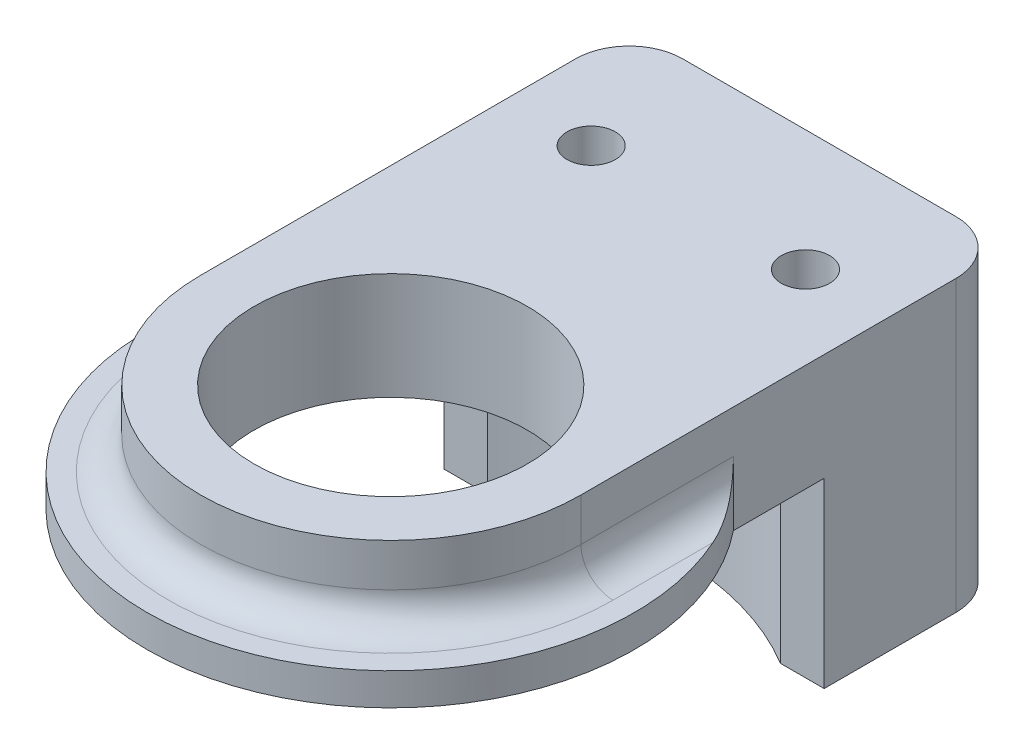
from build123d import *

# Parameters (mm, degrees)
SKETCH1_R           = 22.75
SKETCH1_R_2         = 12.75
BOSS_EXTRUDE1_DEPTH = 3
SKETCH2_R           = 12.75
BOSS_EXTRUDE2_DEPTH = 7
BOSS_EXTRUDE3_START = 3
BOSS_EXTRUDE3_DEPTH = 3
FILLET4_R           = 5
SKETCH4_R           = 2.25
CUT_EXTRUDE1_DEPTH  = 15
FILLET5_R           = 3
SKETCH6_R           = 2.25
BOSS_EXTRUDE4_DEPTH = 17
SKETCH7_R           = 26.5
CUT_EXTRUDE3_DEPTH  = 30


with BuildPart() as part:
    # Sketch1 → Boss-Extrude1 (new body)
    with BuildSketch(Plane(origin=(0, 0, 0), x_dir=(1, 0, 0), z_dir=(0, 1, 0))):
        with Locations(Location((0, 0, 0), (0, 0, 270))):
            Circle(SKETCH1_R)
        with Locations(Location((0, 0, 0), (0, 0, 270))):
            Circle(SKETCH1_R_2, mode=Mode.SUBTRACT)
    extrude(amount=BOSS_EXTRUDE1_DEPTH)

    # Sketch2 → Boss-Extrude2 (add)
    with BuildSketch(Plane(origin=(0, 3, 0), x_dir=(1, 0, 0), z_dir=(0, 1, 0))):
        with BuildLine():
            Line((17.75, 0), (17.75, 40))
            Line((17.75, 40), (-17.75, 40))
            Line((-17.75, 40), (-17.75, 0))
            ThreePointArc((-17.75, 0), (-14.209371907, -10.637492656), (-5, -17.03122133))
            ThreePointArc((-5, -17.03122133), (0, -17.75), (5, -17.03122133))
            ThreePointArc((5, -17.03122133), (14.209371907, -10.637492656), (17.75, 0))
        make_face()
        with Locations(Location((0, 0, 0), (0, 0, 270))):
            Circle(SKETCH2_R, mode=Mode.SUBTRACT)
    extrude(amount=BOSS_EXTRUDE2_DEPTH)

    # Sketch3 → Boss-Extrude3 (add)
    with BuildSketch(Plane.XZ.offset(-3).offset(BOSS_EXTRUDE3_START)):
        with BuildLine():
            Line((17.75, -40), (17.75, -14.230249471))
            ThreePointArc((17.75, -14.230249471), (0, -22.75), (-17.75, -14.230249471))
            Line((-17.75, -14.230249471), (-17.75, -40))
            Line((-17.75, -40), (17.75, -40))
        make_face()
    extrude(amount=-BOSS_EXTRUDE3_DEPTH)

    # Fillet4
    fillet4_edges = [part.edges().sort_by_distance(p)[0] for p in [
        (17.75, 5, -40),
        (-17.75, 5, -40),
    ]]
    fillet(fillet4_edges, radius=FILLET4_R)

    # Sketch4 → Cut-Extrude1 (cut)
    with BuildSketch(Plane(origin=(0, 10, 0), x_dir=(1, 0, 0), z_dir=(0, 1, 0))):
        with Locations(Location((10, 28.707521, 0), (0, 0, 270))):
            Circle(SKETCH4_R)
        with Locations(Location((-10, 28.707521, 0), (0, 0, 270))):
            Circle(SKETCH4_R)
    extrude(amount=-CUT_EXTRUDE1_DEPTH, mode=Mode.SUBTRACT)

    # Fillet5
    fillet5_edges = [part.edges().sort_by_distance(p)[0] for p in [
        (-17.75, 3, -7.115124735),
        (17.75, 3, -7.115124735),
        (0, 3, 17.75),
    ]]
    fillet(fillet5_edges, radius=FILLET5_R)

    # Sketch6 → Boss-Extrude4 (add)
    with BuildSketch(Plane(origin=(0, 0, 0), x_dir=(-1, 0, 0), z_dir=(0, -1, 0))):
        with BuildLine():
            Line((17.75, 22.7), (17.75, 35))
            ThreePointArc((17.75, 35), (16.285533906, 38.535533906), (12.75, 40))
            Line((12.75, 40), (-12.75, 40))
            ThreePointArc((-12.75, 40), (-16.285533906, 38.535533906), (-17.75, 35))
            Line((-17.75, 35), (-17.75, 22.7))
            Line((-17.75, 22.7), (17.75, 22.7))
        make_face()
        with Locations(Location((10, 28.707521, 0), (0, 0, 270))):
            Circle(SKETCH6_R, mode=Mode.SUBTRACT)
        with Locations(Location((-10, 28.707521, 0), (0, 0, 270))):
            Circle(SKETCH6_R, mode=Mode.SUBTRACT)
    extrude(amount=BOSS_EXTRUDE4_DEPTH)

    # Sketch7 → Cut-Extrude3 (cut)
    with BuildSketch(Plane(origin=(0, 0, 0), x_dir=(-1, 0, 0), z_dir=(0, -1, 0))):
        Circle(SKETCH7_R)
    extrude(amount=CUT_EXTRUDE3_DEPTH, mode=Mode.SUBTRACT)


solid = part.part
